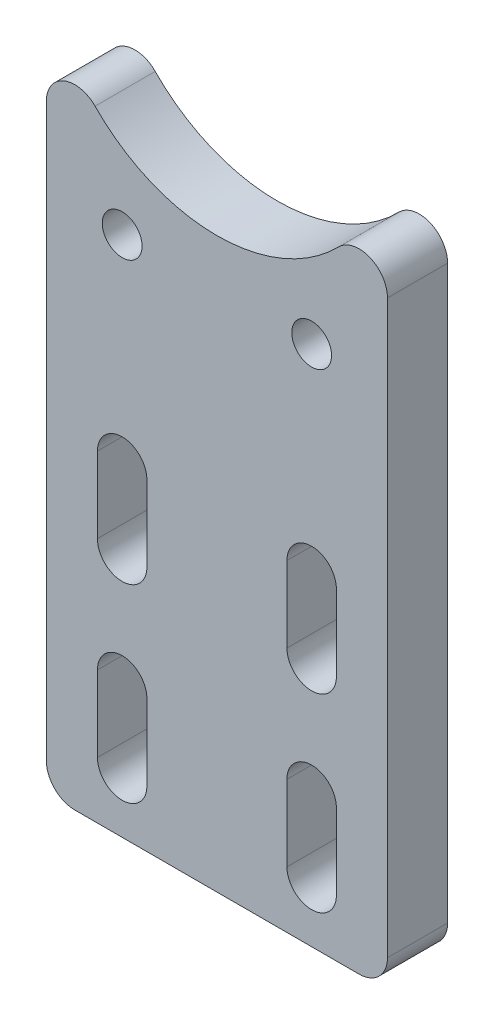
from build123d import *

# Parameters (mm, degrees)
BOSS_EXTRUDE1_DEPTH         = 6.35
FILLET1_R                   = 3
CUT_EXTRUDE1_REACH          = 82.301
TAP_DRILL_FOR_M5X0_8_TAP1_D = 4.2


with BuildPart() as part:
    # Sketch1 → Boss-Extrude1 (new body)
    with BuildSketch(Plane.XY):
        with BuildLine():
            Line((18, 0), (18, -78))
            Line((18, -78), (-18, -78))
            Line((-18, -78), (-18, 0))
            ThreePointArc((-18, 0), (0, -18), (18, 0))
        make_face()
    extrude(amount=BOSS_EXTRUDE1_DEPTH)

    # Fillet1
    fillet1_edges = [part.edges().sort_by_distance(p)[0] for p in [
        (18, 0, 3.175),
        (18, -78, 3.175),
        (-18, -78, 3.175),
        (-18, 0, 3.175),
    ]]
    fillet(fillet1_edges, radius=FILLET1_R)

    # Sketch2 → Cut-Extrude1 (cut, up to next)
    with BuildSketch(Plane.XY.offset(6.35), mode=Mode.PRIVATE) as cut_extrude1_sk1:
        with BuildLine():
            Line((-12.61, -72), (-12.61, -64))
            ThreePointArc((-12.61, -64), (-10, -61.39), (-7.39, -64))
            Line((-7.39, -64), (-7.39, -72))
            ThreePointArc((-7.39, -72), (-10, -74.61), (-12.61, -72))
        make_face()
    cut_extrude1_tool1 = extrude(cut_extrude1_sk1.sketch, amount=-CUT_EXTRUDE1_REACH, mode=Mode.PRIVATE) & part.part
    # Sketch2 → Cut-Extrude1 (cut, up to next)
    with BuildSketch(Plane.XY.offset(6.35), mode=Mode.PRIVATE) as cut_extrude1_sk2:
        with BuildLine():
            Line((-12.61, -52), (-12.61, -44))
            ThreePointArc((-12.61, -44), (-10, -41.39), (-7.39, -44))
            Line((-7.39, -44), (-7.39, -52))
            ThreePointArc((-7.39, -52), (-10, -54.61), (-12.61, -52))
        make_face()
    cut_extrude1_tool2 = extrude(cut_extrude1_sk2.sketch, amount=-CUT_EXTRUDE1_REACH, mode=Mode.PRIVATE) & part.part
    # Sketch2 → Cut-Extrude1 (cut, up to next)
    with BuildSketch(Plane.XY.offset(6.35), mode=Mode.PRIVATE) as cut_extrude1_sk3:
        with BuildLine():
            Line((12.61, -72), (12.61, -64))
            ThreePointArc((12.61, -64), (10, -61.39), (7.39, -64))
            Line((7.39, -64), (7.39, -72))
            ThreePointArc((7.39, -72), (10, -74.61), (12.61, -72))
        make_face()
    cut_extrude1_tool3 = extrude(cut_extrude1_sk3.sketch, amount=-CUT_EXTRUDE1_REACH, mode=Mode.PRIVATE) & part.part
    # Sketch2 → Cut-Extrude1 (cut, up to next)
    with BuildSketch(Plane.XY.offset(6.35), mode=Mode.PRIVATE) as cut_extrude1_sk4:
        with BuildLine():
            Line((12.61, -52), (12.61, -44))
            ThreePointArc((12.61, -44), (10, -41.39), (7.39, -44))
            Line((7.39, -44), (7.39, -52))
            ThreePointArc((7.39, -52), (10, -54.61), (12.61, -52))
        make_face()
    cut_extrude1_tool4 = extrude(cut_extrude1_sk4.sketch, amount=-CUT_EXTRUDE1_REACH, mode=Mode.PRIVATE) & part.part
    add(cut_extrude1_tool1.solids().sort_by_distance((-10, -68, 6.35))[0], mode=Mode.SUBTRACT)
    add(cut_extrude1_tool2.solids().sort_by_distance((-10, -48, 6.35))[0], mode=Mode.SUBTRACT)
    add(cut_extrude1_tool3.solids().sort_by_distance((10, -68, 6.35))[0], mode=Mode.SUBTRACT)
    add(cut_extrude1_tool4.solids().sort_by_distance((10, -48, 6.35))[0], mode=Mode.SUBTRACT)

    # Tap Drill for M5x0.8 Tap1 (through all)
    with Locations(Plane(origin=(-10, -22.912878475, 6.35), x_dir=(1, 0, 0), z_dir=(0, 0, 1))):
        with Locations((0, 0), (20, 0)):
            Hole(TAP_DRILL_FOR_M5X0_8_TAP1_D / 2)


solid = part.part
